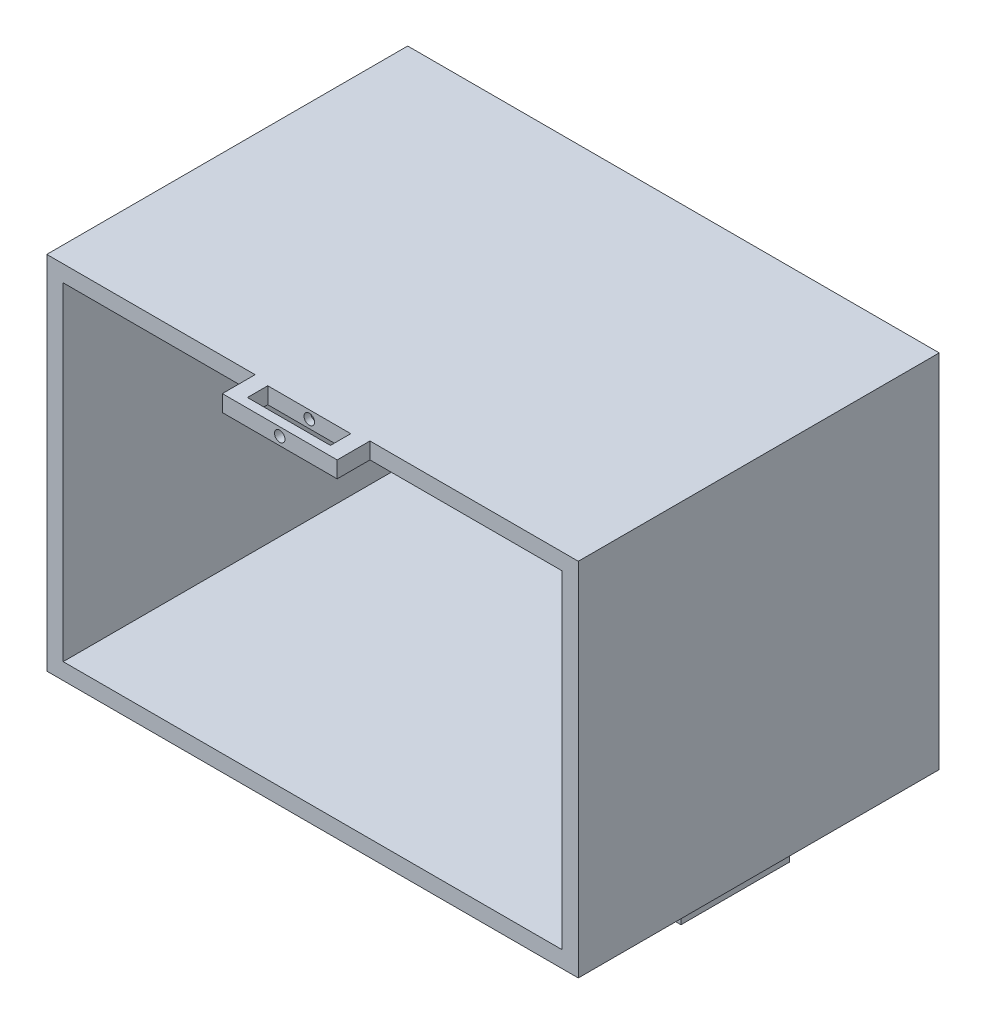
from build123d import *

# Parameters (mm, degrees)
SKETCH1_W           = 162
SKETCH1_H           = 110
BOSS_EXTRUDE1_DEPTH = 55
SHELL1_T            = -5
BOSS_EXTRUDE3_DEPTH = 15
SKETCH6_W           = 17
SKETCH6_H           = 10.3
BOSS_EXTRUDE4_DEPTH = 3
SKETCH8_W           = 10
SKETCH8_H           = 5
BOSS_EXTRUDE5_DEPTH = 17.5
SKETCH9_W           = 25.3
SKETCH9_H           = 6.2
CUT_EXTRUDE1_DEPTH  = 5
SKETCH10_R          = 1.6
CUT_EXTRUDE2_DEPTH  = 11


with BuildPart() as part:
    # Sketch1 → Boss-Extrude1 (new, symmetric)
    with BuildSketch(Plane.XY):
        Rectangle(SKETCH1_W, SKETCH1_H)
    extrude(amount=BOSS_EXTRUDE1_DEPTH, both=True)

    # Shell1
    shell1_openings = [part.faces().sort_by_distance(p)[0] for p in [
        (0, 0, 55),
    ]]
    offset(amount=SHELL1_T, openings=shell1_openings, kind=Kind.INTERSECTION)

    # Sketch5 → Boss-Extrude3 (add, symmetric)
    with BuildSketch(Plane.XY):
        Polygon((-67.3, -55), (-67.3, -60.3), (-55.3, -60.3), (-55.3, -65.3), (-72.3, -65.3), (-72.3, -55), align=None)
        Polygon((67.3, -55), (67.3, -60.3), (55.3, -60.3), (55.3, -65.3), (72.3, -65.3), (72.3, -55), align=None)
    extrude(amount=BOSS_EXTRUDE3_DEPTH, both=True)

    # Sketch6 → Boss-Extrude4 (add)
    with BuildSketch(Plane(origin=(0, 0, -15), x_dir=(-1, 0, 0), z_dir=(0, 0, -1))):
        with Locations((63.8, -60.15)):
            Rectangle(SKETCH6_W, SKETCH6_H)
        with Locations((-63.8, -60.15)):
            Rectangle(SKETCH6_W, SKETCH6_H)
    extrude(amount=BOSS_EXTRUDE4_DEPTH)

    # Sketch8 → Boss-Extrude5 (add, symmetric)
    with BuildSketch(Plane(origin=(0, 0, 0), x_dir=(0, 0, -1), z_dir=(1, 0, 0))):
        with Locations((-60, 52.5)):
            Rectangle(SKETCH8_W, SKETCH8_H)
    extrude(amount=BOSS_EXTRUDE5_DEPTH, both=True)

    # Sketch9 → Cut-Extrude1 (cut)
    with BuildSketch(Plane(origin=(0, 55, 0), x_dir=(1, 0, 0), z_dir=(0, 1, 0))):
        with Locations((0, -59.1)):
            Rectangle(SKETCH9_W, SKETCH9_H)
    extrude(amount=-CUT_EXTRUDE1_DEPTH, mode=Mode.SUBTRACT)

    # Sketch10 → Cut-Extrude2 (cut)
    with BuildSketch(Plane.XY.offset(65)):
        with Locations((0, 52.5)):
            Circle(SKETCH10_R)
    extrude(amount=-CUT_EXTRUDE2_DEPTH, mode=Mode.SUBTRACT)


solid = part.part
